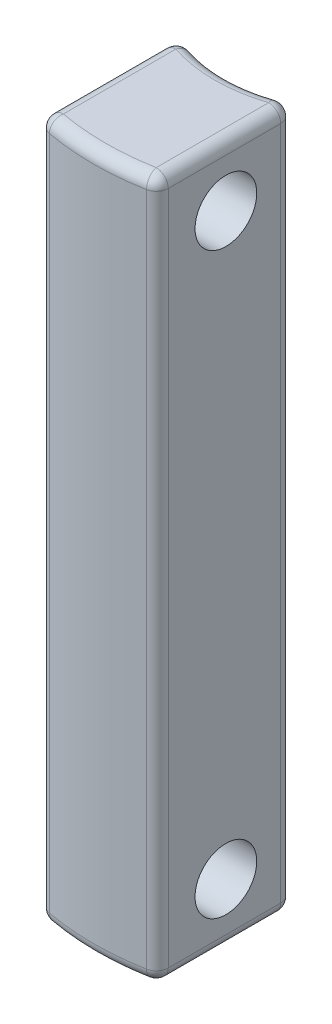
from build123d import *

# Parameters (mm, degrees)
BOSS_EXTRUDE1_DEPTH      = 19.05
BOSS_EXTRUDE1_DEPTH_BACK = 54.61
SKETCH2_R                = 3.2512
CUT_EXTRUDE1_DEPTH       = 9.525
FILLET1_R                = 1.27


with BuildPart() as part:
    # Sketch1 → Boss-Extrude1 (new, two sides: drawn at the far end of the back side and taken through both)
    with BuildSketch(Plane(origin=(0, 0, 0), x_dir=(1, 0, 0), z_dir=(0, 1, 0)).offset(-BOSS_EXTRUDE1_DEPTH_BACK)):
        with BuildLine():
            Line((6.1595, -12.990051451), (6.1595, -27.747157521))
            ThreePointArc((6.1595, -27.747157521), (0, -28.4226), (-6.1595, -27.747157521))
            Line((-6.1595, -27.747157521), (-6.1595, -12.990051451))
            ThreePointArc((-6.1595, -12.990051451), (0, -14.3764), (6.1595, -12.990051451))
        make_face()
    extrude(amount=BOSS_EXTRUDE1_DEPTH + BOSS_EXTRUDE1_DEPTH_BACK)

    # Sketch2 → Cut-Extrude1 (cut, symmetric)
    with BuildSketch(Plane(origin=(0, 0, 0), x_dir=(0, 0, -1), z_dir=(1, 0, 0))):
        with Locations((-20.6375, 12.7)):
            Circle(SKETCH2_R)
        with Locations((-20.6375, -48.26)):
            Circle(SKETCH2_R)
    extrude(amount=CUT_EXTRUDE1_DEPTH, both=True, mode=Mode.SUBTRACT)

    # Fillet1
    fillet1_edges = [part.edges().sort_by_distance(p)[0] for p in [
        (0, -54.61, 28.4226),
        (0, 19.05, 14.3764),
        (-6.1595, 19.05, 20.368604486),
        (6.1595, -54.61, 20.368604486),
        (0, 19.05, 28.4226),
        (6.1595, 19.05, 20.368604486),
        (0, -54.61, 14.3764),
        (-6.1595, -54.61, 20.368604486),
        (6.1595, -17.78, 12.990051451),
        (6.1595, -17.78, 27.747157521),
        (-6.1595, -17.78, 27.747157521),
        (-6.1595, -17.78, 12.990051451),
    ]]
    fillet(fillet1_edges, radius=FILLET1_R)


solid = part.part
